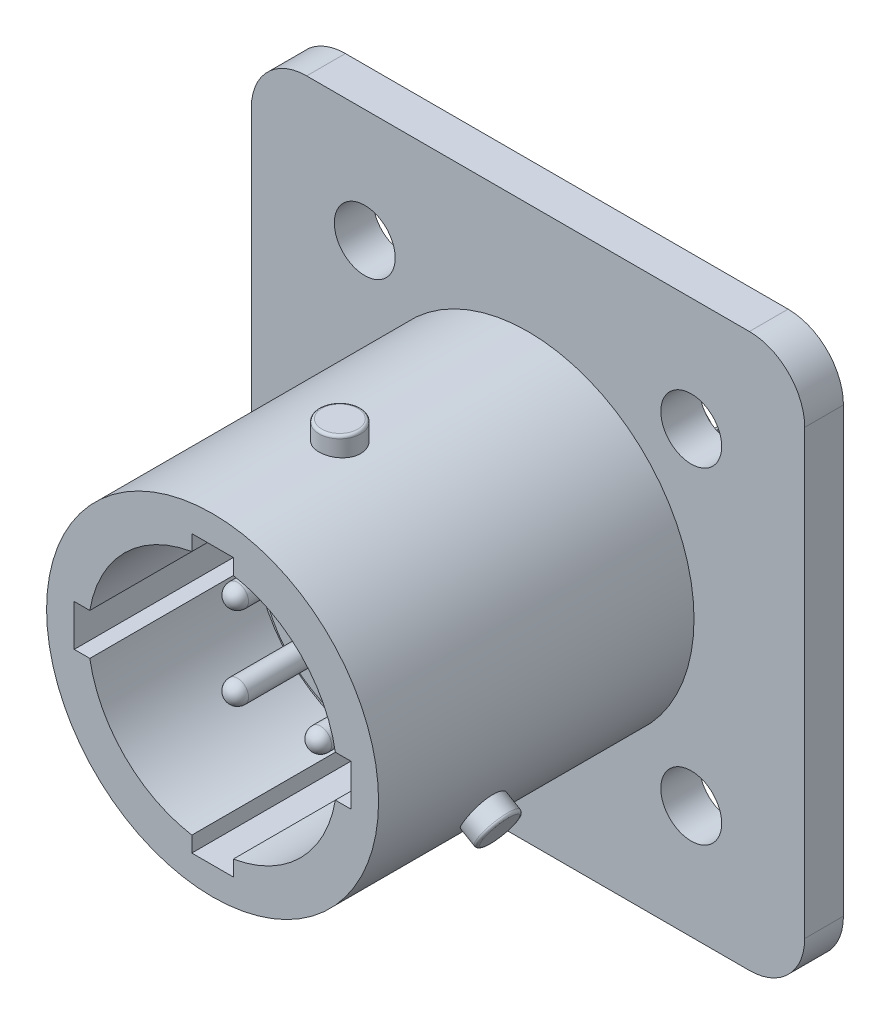
from build123d import *

# Parameters (mm, degrees)
SKETCH_1_W               = 20
SKETCH_1_H               = 20
EXTRUDE_1_DEPTH          = 0.7
SKETCH_2_R               = 1.1
CUT_EXTRUDE_1_DEPTH      = 3.4
SKETCH_4_R               = 5
EXTRUDE_2_DEPTH          = 1.6
SKETCH_5_R               = 6
EXTRUDE_3_DEPTH          = 11.4
SKETCH_6_R               = 4
SKETCH_6_R_2             = 0.5
CUT_EXTRUDE_2_DEPTH      = 1.6
EXTRUDE_START            = 2
SKETCH_7_R               = 0.5
EXTRUDE_4_DEPTH          = 2
CUT_EXTRUDE_3_DEPTH      = 6
FILLET_1_R               = 2
SKETCH_10_R              = 0.4
CUT_EXTRUDE_4_DEPTH      = 3
CUT_EXTRUDE_5_DEPTH      = 6
SKETCH_12_R              = 3.75
EXTRUDE_5_DEPTH          = 0.5
SKETCH_13_R              = 0.4
EXTRUDE_6_DEPTH          = 3.5
FILLET_2_R               = 0.4
PATTERN_CIRCULAR_1_COUNT = 3


with BuildPart() as part:
    # Эскиз1 → Бобышка-Вытянуть1 (new, symmetric)
    with BuildSketch(Plane.XY):
        Rectangle(SKETCH_1_W, SKETCH_1_H)
    extrude(amount=EXTRUDE_1_DEPTH, both=True)

    # Эскиз2 → Вырез-Вытянуть1 (cut)
    with BuildSketch(Plane.XY.offset(0.7)):
        with Locations((-5.9, 5.9)):
            Circle(SKETCH_2_R)
        with Locations((5.9, 5.9)):
            Circle(SKETCH_2_R)
        with Locations((5.9, -5.9)):
            Circle(SKETCH_2_R)
        with Locations((-5.9, -5.9)):
            Circle(SKETCH_2_R)
    extrude(amount=-CUT_EXTRUDE_1_DEPTH, mode=Mode.SUBTRACT)

    # Эскиз4 → Бобышка-Вытянуть2 (add)
    with BuildSketch(Plane(origin=(0, 0, -0.7), x_dir=(-1, 0, 0), z_dir=(0, 0, -1))):
        with Locations(Location((0, 0, 0), (0, 0, 180))):
            Circle(SKETCH_4_R)
    extrude(amount=EXTRUDE_2_DEPTH)

    # Эскиз5 → Бобышка-Вытянуть3 (add)
    with BuildSketch(Plane.XY.offset(0.7)):
        Circle(SKETCH_5_R)
    extrude(amount=EXTRUDE_3_DEPTH)

    # Эскиз6 → Вырез-Вытянуть2 (cut)
    with BuildSketch(Plane(origin=(0, 0, -2.3), x_dir=(-1, 0, 0), z_dir=(0, 0, -1))):
        Circle(SKETCH_6_R)
        with Locations((-1.5, 1.5)):
            Circle(SKETCH_6_R_2, mode=Mode.SUBTRACT)
        with Locations(Location((1.5, 1.5, 0), (0, 0, 180))):
            Circle(SKETCH_6_R_2, mode=Mode.SUBTRACT)
        with Locations((1.5, -1.5)):
            Circle(SKETCH_6_R_2, mode=Mode.SUBTRACT)
        with Locations(Location((-1.5, -1.5, 0), (0, 0, 180))):
            Circle(SKETCH_6_R_2, mode=Mode.SUBTRACT)
    extrude(amount=-CUT_EXTRUDE_2_DEPTH, mode=Mode.SUBTRACT)

    # Эскиз7 → Бобышка-Вытянуть4 (add)
    with BuildSketch(Plane(origin=(0, 0, -2.3), x_dir=(-1, 0, 0), z_dir=(0, 0, -1)).offset(EXTRUDE_START)):
        with Locations((-1.5, 1.5)):
            Circle(SKETCH_7_R)
        with Locations((-1.5, -1.5)):
            Circle(SKETCH_7_R)
        with Locations((1.5, -1.5)):
            Circle(SKETCH_7_R)
        with Locations((1.5, 1.5)):
            Circle(SKETCH_7_R)
    extrude(amount=-EXTRUDE_4_DEPTH)

    # Эскиз8 → Вырез-Вытянуть3 (cut, symmetric)
    with BuildSketch(Plane(origin=(0, 0, 0), x_dir=(0, 0, -1), z_dir=(1, 0, 0))):
        with BuildLine():
            Line((4.3, 2), (2.872634235, 2))
            ThreePointArc((2.872634235, 2), (3.537232498, 1.60987659), (4.3, 1.5))
            Line((4.3, 1.5), (4.3, 2))
        make_face()
        with BuildLine():
            Line((4.3, -1), (2.872634235, -1))
            ThreePointArc((2.872634235, -1), (3.537232498, -1.39012341), (4.3, -1.5))
            Line((4.3, -1.5), (4.3, -1))
        make_face()
    extrude(amount=CUT_EXTRUDE_3_DEPTH, both=True, mode=Mode.SUBTRACT)

    # Скругление1
    fillet_1_edges = [part.edges().sort_by_distance(p)[0] for p in [
        (10, -10, 0),
        (-10, -10, 0),
        (-10, 10, 0),
        (10, 10, 0),
    ]]
    fillet(fillet_1_edges, radius=FILLET_1_R)

    # Эскиз10 → Вырез-Вытянуть4 (cut)
    with BuildSketch(Plane(origin=(0, 0, -4.3), x_dir=(-1, 0, 0), z_dir=(0, 0, -1))):
        with Locations((1.5, 1.5)):
            Circle(SKETCH_10_R)
        with Locations((-1.5, 1.5)):
            Circle(SKETCH_10_R)
        with Locations((-1.5, -1.5)):
            Circle(SKETCH_10_R)
        with Locations((1.5, -1.5)):
            Circle(SKETCH_10_R)
    extrude(amount=-CUT_EXTRUDE_4_DEPTH, mode=Mode.SUBTRACT)

    # Эскиз11 → Вырез-Вытянуть5 (cut)
    with BuildSketch(Plane.XY.offset(12.1)):
        with BuildLine():
            Line((-0.75, 5), (0.75, 5))
            Line((0.75, 5), (0.75, 4.437059837))
            ThreePointArc((0.75, 4.437059837), (3.181980515, 3.181980515), (4.437059837, 0.75))
            Line((4.437059837, 0.75), (5, 0.75))
            Line((5, 0.75), (5, -0.75))
            Line((5, -0.75), (4.437059837, -0.75))
            ThreePointArc((4.437059837, -0.75), (3.181980515, -3.181980515), (0.75, -4.437059837))
            Line((0.75, -4.437059837), (0.75, -5))
            Line((0.75, -5), (-0.75, -5))
            Line((-0.75, -5), (-0.75, -4.437059837))
            ThreePointArc((-0.75, -4.437059837), (-3.181980515, -3.181980515), (-4.437059837, -0.75))
            Line((-4.437059837, -0.75), (-5, -0.75))
            Line((-5, -0.75), (-5, 0.75))
            Line((-5, 0.75), (-4.437059837, 0.75))
            ThreePointArc((-4.437059837, 0.75), (-3.181980515, 3.181980515), (-0.75, 4.437059837))
            Line((-0.75, 4.437059837), (-0.75, 5))
        make_face()
    extrude(amount=-CUT_EXTRUDE_5_DEPTH, mode=Mode.SUBTRACT)

    # Эскиз12 → Бобышка-Вытянуть5 (add)
    with BuildSketch(Plane.XY.offset(6.1)):
        Circle(SKETCH_12_R)
    extrude(amount=EXTRUDE_5_DEPTH)

    # Эскиз13 → Бобышка-Вытянуть6 (add)
    with BuildSketch(Plane.XY.offset(6.6)):
        with Locations(Location((1.5, 1.5, 0), (0, 0, 180))):
            Circle(SKETCH_13_R)
        with Locations(Location((-1.5, 1.5, 0), (0, 0, 180))):
            Circle(SKETCH_13_R)
        with Locations(Location((1.5, -1.5, 0), (0, 0, 180))):
            Circle(SKETCH_13_R)
        with Locations(Location((-1.5, -1.5, 0), (0, 0, 180))):
            Circle(SKETCH_13_R)
    extrude(amount=EXTRUDE_6_DEPTH)

    # Скругление2
    fillet_2_edges = [part.edges().sort_by_distance(p)[0] for p in [
        (1.9, 1.5, 10.1),
        (-1.1, 1.5, 10.1),
        (1.9, -1.5, 10.1),
        (-1.1, -1.5, 10.1),
    ]]
    fillet(fillet_2_edges, radius=FILLET_2_R)

    # Эскиз14 → Повернуть1 (revolve)
    with BuildSketch(Plane.XY.offset(7.5), mode=Mode.PRIVATE) as revolve_1_sk:
        with BuildLine():
            Line((0, 6.668613329), (0.65, 6.668613329))
            ThreePointArc((0.65, 6.668613329), (0.720710678, 6.639324007), (0.75, 6.568613329))
            Line((0.75, 6.568613329), (0.75, 5.868613329))
            Line((0.75, 5.868613329), (0, 5.868613329))
            Line((0, 5.868613329), (0, 6.668613329))
        make_face()
    revolve_1 = revolve(revolve_1_sk.sketch.rotate(Axis((0, 6.826415176, 7.5), (0, -1, 0)), 90), axis=Axis((0, 6.826415176, 7.5), (0, -1, 0)))

    # Круговой массив1: Повернуть1 ×3 about axis
    pattern_circular_1_axis = Axis((0, 0, 0), (0, 0, 1))
    for i in range(1, PATTERN_CIRCULAR_1_COUNT):
        add(revolve_1.rotate(pattern_circular_1_axis, i * 360 / PATTERN_CIRCULAR_1_COUNT))


solid = part.part
